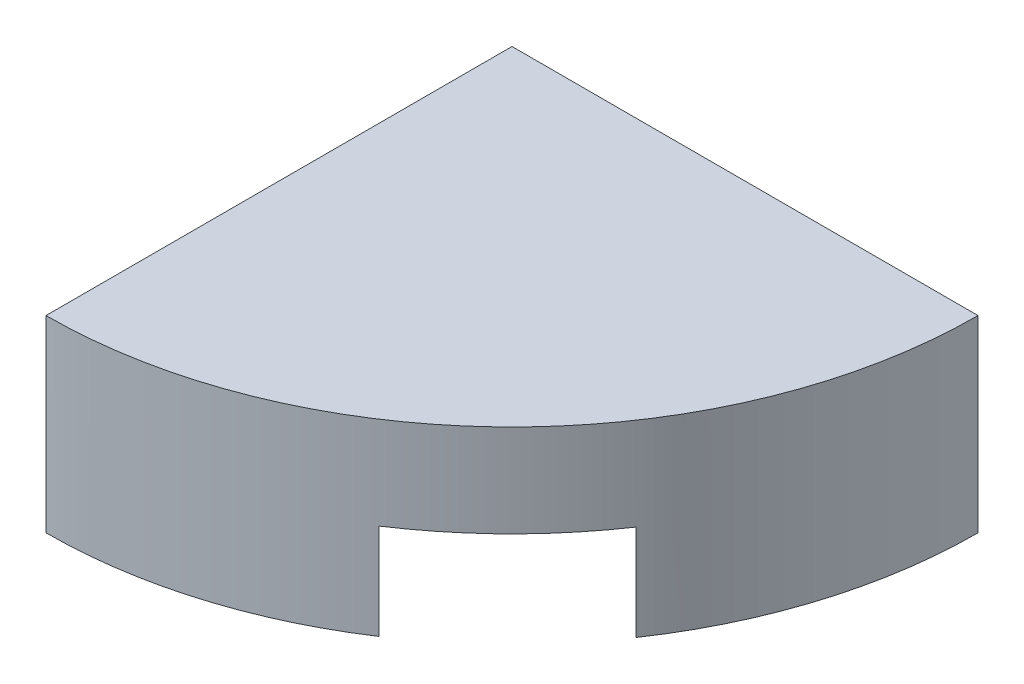
from build123d import *

# Parameters (mm, degrees)
BOSS_EXTRUDE1_DEPTH = 3.15
SHELL1_T            = -1.55
SKETCH2_R           = 2.440449026
CUT_EXTRUDE1_DEPTH  = 1.6


with BuildPart() as part:
    # Sketch1 → Boss-Extrude1 (new body)
    with BuildSketch(Plane(origin=(0, 0, 0), x_dir=(1, 0, 0), z_dir=(0, 1, 0))):
        with BuildLine():
            Line((0, 0), (0, -7.8))
            ThreePointArc((0, -7.8), (5.515432893, -5.515432893), (7.8, 0))
            Line((7.8, 0), (0, 0))
        make_face()
    extrude(amount=-BOSS_EXTRUDE1_DEPTH)

    # Shell1
    shell1_openings = [part.faces().sort_by_distance(p)[0] for p in [
        (3.310422816, -3.15, 3.310422816),
    ]]
    offset(amount=SHELL1_T, openings=shell1_openings, kind=Kind.INTERSECTION)

    # Sketch2 → Cut-Extrude1 (cut)
    with BuildSketch(Plane.XZ.offset(1.55)):
        with Locations((4.030998371, 4.088310158)):
            Circle(SKETCH2_R)
    extrude(amount=CUT_EXTRUDE1_DEPTH, mode=Mode.SUBTRACT)


solid = part.part
